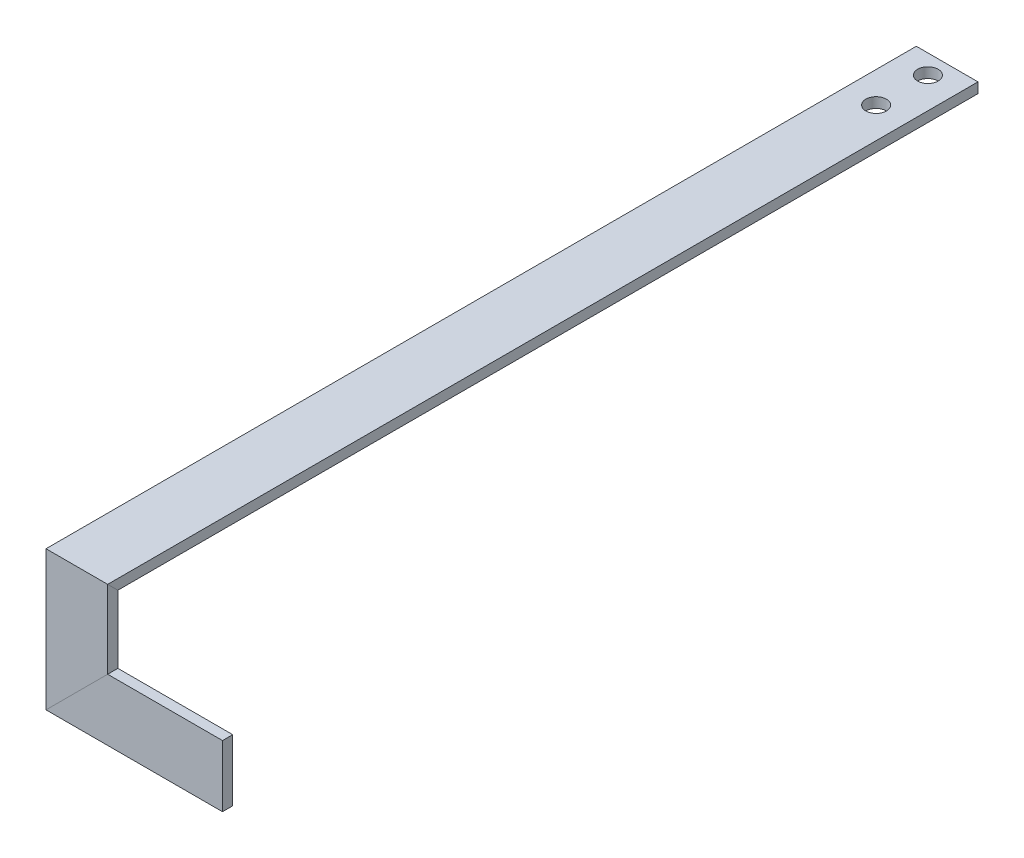
from build123d import *

# Parameters (mm, degrees)
CROQUIS1_W            = 38.1
CROQUIS1_H            = 6.31
CROQUIS2_R            = 6.35
CORTAR_EXTRUIR1_DEPTH = 6.31


with BuildPart() as part:
    # Barrer1: sweep along a curve in space
    with BuildLine() as barrer1_path:
        Line((0, 0, 0), (0, 0, 534.55))
        Line((0, 0, 534.55), (0, -64, 534.55))
        Line((0, -64, 534.55), (90, -64, 534.55))
    # Croquis1 → Barrer1 (sweep)
    with BuildSketch(Plane.XY):
        Rectangle(CROQUIS1_W, CROQUIS1_H)
    sweep(path=barrer1_path.line, transition=Transition.RIGHT)

    # Croquis2 → Cortar-Extruir1 (cut)
    with BuildSketch(Plane(origin=(0, 3.155, 0), x_dir=(1, 0, 0), z_dir=(0, 1, 0))):
        with Locations(Location((0, -43.892204666, 0), (0, 0, 270))):
            Circle(CROQUIS2_R)
        with Locations(Location((0, -11.892204666, 0), (0, 0, 270))):
            Circle(CROQUIS2_R)
    extrude(amount=-CORTAR_EXTRUIR1_DEPTH, mode=Mode.SUBTRACT)


solid = part.part
